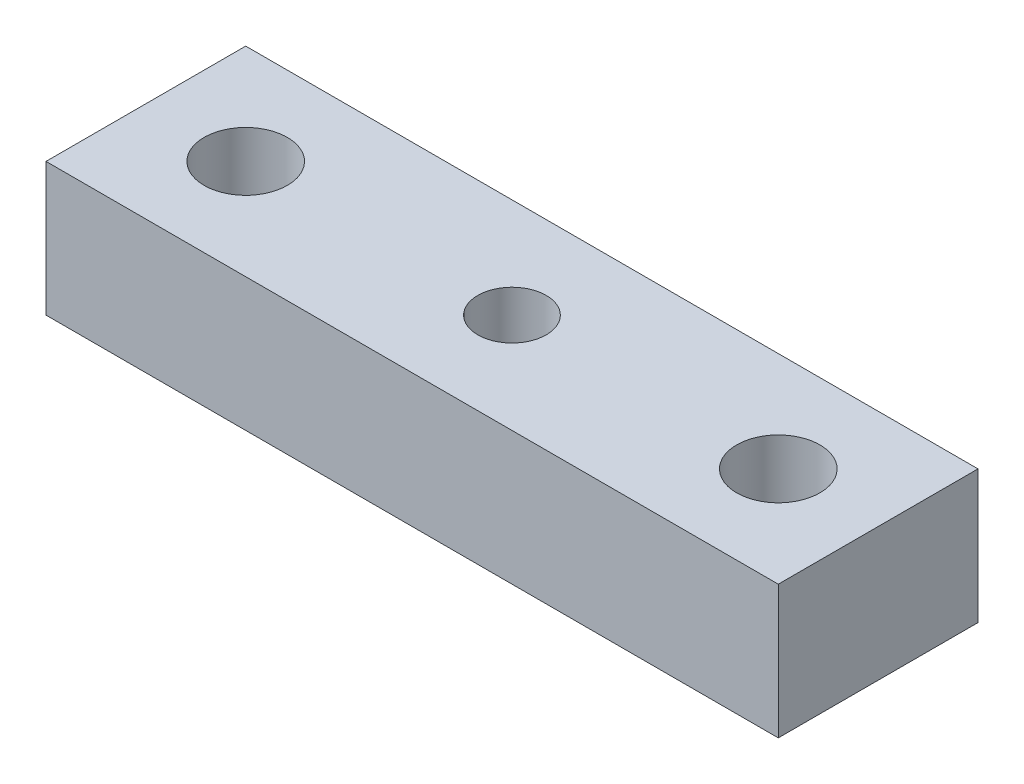
from build123d import *

# Parameters (mm, degrees)
SKETCH1_W                      = 69.85
SKETCH1_H                      = 12.7
BOSS_EXTRUDE1_DEPTH            = 19.05
F_5_16_0_3125_DIAMETER_HOLE1_D = 7.9375
F_5_16_18_TAPPED_HOLE1_D       = 6.5278


with BuildPart() as part:
    # Sketch1 → Boss-Extrude1 (new body)
    with BuildSketch(Plane.XY):
        Rectangle(SKETCH1_W, SKETCH1_H)
    extrude(amount=BOSS_EXTRUDE1_DEPTH)

    # 5/16 (0.3125) Diameter Hole1 (through all)
    with Locations(Plane(origin=(0, 6.35, 0), x_dir=(1, 0, 0), z_dir=(0, 1, 0))):
        with Locations((-25.4, -9.525), (25.4, -9.525)):
            Hole(F_5_16_0_3125_DIAMETER_HOLE1_D / 2)

    # 5/16-18 Tapped Hole1 (through all)
    with Locations(Plane(origin=(0, 6.35, 0), x_dir=(1, 0, 0), z_dir=(0, 1, 0))):
        with Locations((0, -9.525)):
            Hole(F_5_16_18_TAPPED_HOLE1_D / 2)


solid = part.part
